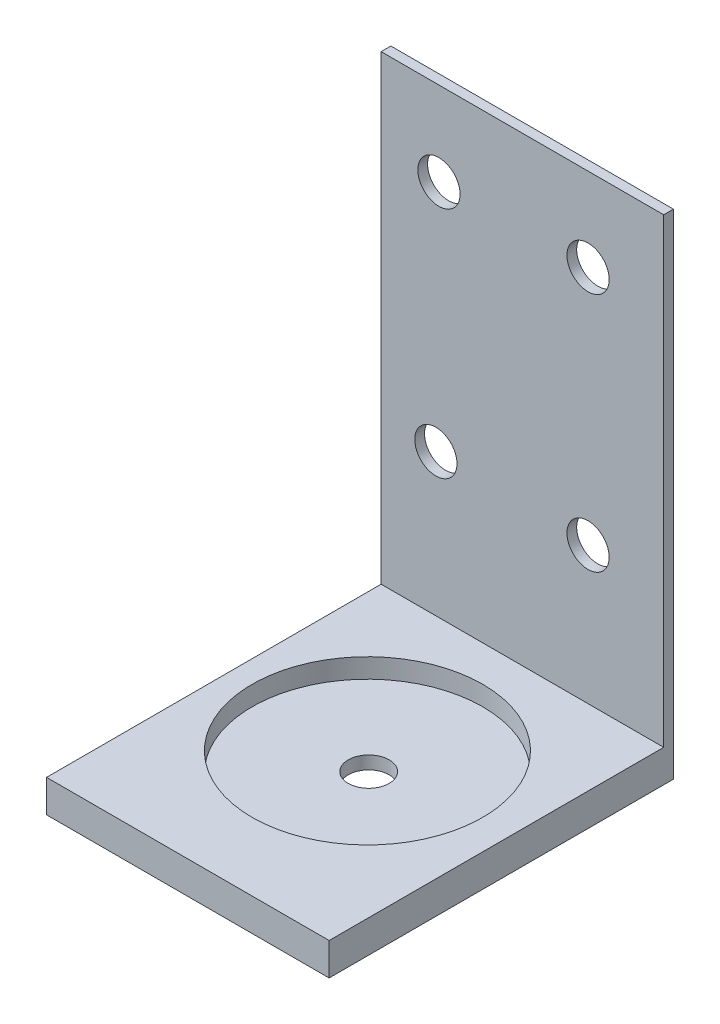
from build123d import *

# Parameters (mm, degrees)
SKETCH1_W           = 22.098
SKETCH1_H           = 26.924
BOSS_EXTRUDE1_DEPTH = 2.54
SKETCH2_W           = 22.098
SKETCH2_H           = 0.762
BOSS_EXTRUDE2_DEPTH = 36.068
SKETCH4_R           = 1.651
CUT_EXTRUDE1_DEPTH  = 0.762
SKETCH3_R           = 9.017
CUT_EXTRUDE2_DEPTH  = 1.524
SKETCH5_R           = 1.599485458
CUT_EXTRUDE3_DEPTH  = 1.27
SKETCH6_R           = 1.651
CUT_EXTRUDE4_DEPTH  = 0.762


with BuildPart() as part:
    # Sketch1 → Boss-Extrude1 (new body)
    with BuildSketch(Plane(origin=(0, 0, 0), x_dir=(1, 0, 0), z_dir=(0, 1, 0))):
        with Locations((-1.642418919, 6.620304054)):
            Rectangle(SKETCH1_W, SKETCH1_H)
    extrude(amount=BOSS_EXTRUDE1_DEPTH)

    # Sketch2 → Boss-Extrude2 (add)
    with BuildSketch(Plane(origin=(0, 2.54, 0), x_dir=(1, 0, 0), z_dir=(0, 1, 0))):
        with Locations((-1.642418919, 19.701304054)):
            Rectangle(SKETCH2_W, SKETCH2_H)
    extrude(amount=BOSS_EXTRUDE2_DEPTH)

    # Sketch4 → Cut-Extrude1 (cut)
    with BuildSketch(Plane.XY.offset(-19.320304054)):
        with Locations((-8.168147535, 32.039555002)):
            Circle(SKETCH4_R)
    extrude(amount=-CUT_EXTRUDE1_DEPTH, mode=Mode.SUBTRACT)

    # Sketch3 → Cut-Extrude2 (cut)
    with BuildSketch(Plane(origin=(0, 2.54, 0), x_dir=(1, 0, 0), z_dir=(0, 1, 0))):
        with Locations(Location((-1.941286503, 7.500303052, 0), (0, 0, 270))):
            Circle(SKETCH3_R)
    extrude(amount=-CUT_EXTRUDE2_DEPTH, mode=Mode.SUBTRACT)

    # Sketch5 → Cut-Extrude3 (cut)
    with BuildSketch(Plane(origin=(0, 1.016, 0), x_dir=(1, 0, 0), z_dir=(0, 1, 0))):
        with Locations(Location((-2.007701522, 7.666340599, 0), (0, 0, 270))):
            Circle(SKETCH5_R)
    extrude(amount=-CUT_EXTRUDE3_DEPTH, mode=Mode.SUBTRACT)

    # Sketch6 → Cut-Extrude4 (cut)
    with BuildSketch(Plane.XY.offset(-19.320304054)):
        with Locations((3.491794036, 32.087538301)):
            Circle(SKETCH6_R)
        with Locations((-8.408064028, 13.661951621)):
            Circle(SKETCH6_R)
        with Locations((3.491794036, 13.278085232)):
            Circle(SKETCH6_R)
    extrude(amount=-CUT_EXTRUDE4_DEPTH, mode=Mode.SUBTRACT)


solid = part.part
